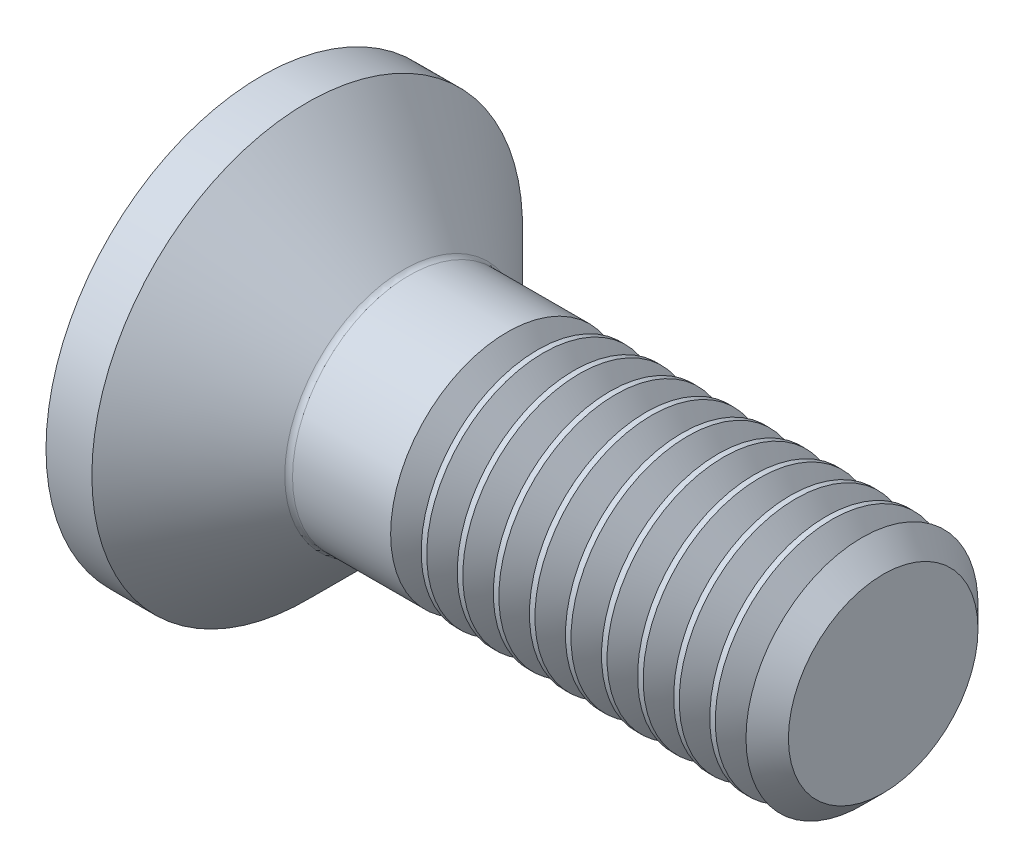
from build123d import *

# Parameters (mm, degrees)
FILLET1_R       = 0.1
HEX_2_DEPTH     = 1.1
THDSCHPAT_COUNT = 10
THDSCHPAT_PITCH = 0.464


with BuildPart() as part:
    # BodySke → BaseBody (revolve)
    with BuildSketch(Plane.XY, mode=Mode.PRIVATE) as basebody_sk:
        Polygon((0, 0), (0, 2.77), (0.59, 2.77), (1.86, 1.5), (7.7195, 1.5), (8, 1.2195), (8, 0), align=None)
    revolve(basebody_sk.sketch.rotate(Axis((0, 0, 0), (1, 0, 0)), 90), axis=Axis((0, 0, 0), (1, 0, 0)))

    # Fillet1
    fillet1_edges = [part.edges().sort_by_distance(p)[0] for p in [
        (1.86, 0, -1.5),
    ]]
    fillet(fillet1_edges, radius=FILLET1_R)

    # Sketch2 → PreBroach (revolve, cut)
    with BuildSketch(Plane.XY, mode=Mode.PRIVATE) as prebroach_sk:
        Polygon((0, 1), (1.1, 1), (1.677350269, 0), (0, 0), align=None)
    revolve(prebroach_sk.sketch.rotate(Axis((0, 0, 0), (1, 0, 0)), 90), axis=Axis((0, 0, 0), (1, 0, 0)), mode=Mode.SUBTRACT)

    # Sketch3 → Hex 2 (cut)
    with BuildSketch(Plane.ZY):
        Polygon((-1, -0.577350269), (-1, 0.577350269), (0, 1.154700538), (1, 0.577350269), (1, -0.577350269), (0, -1.154700538), align=None)
    extrude(amount=-HEX_2_DEPTH, mode=Mode.SUBTRACT)

    # ThdSchSke → ThreadSchematic (revolve, cut)
    with BuildSketch(Plane.XY, mode=Mode.PRIVATE) as threadschematic_sk:
        Polygon((3.360001, -1.2195), (3.163592786, -1.5), (3.163592786, -1.875), (3.556409214, -1.875), (3.556409214, -1.5), align=None)
    threadschematic = revolve(threadschematic_sk.sketch.rotate(Axis((-3.175, 0, 0), (1, 0, 0)), 270), axis=Axis((-3.175, 0, 0), (1, 0, 0)), mode=Mode.SUBTRACT)

    # ThdSchPat: ThreadSchematic ×10
    with Locations(*[(i * THDSCHPAT_PITCH, 0, 0) for i in range(1, THDSCHPAT_COUNT)]):
        add(threadschematic, mode=Mode.SUBTRACT)


solid = part.part
